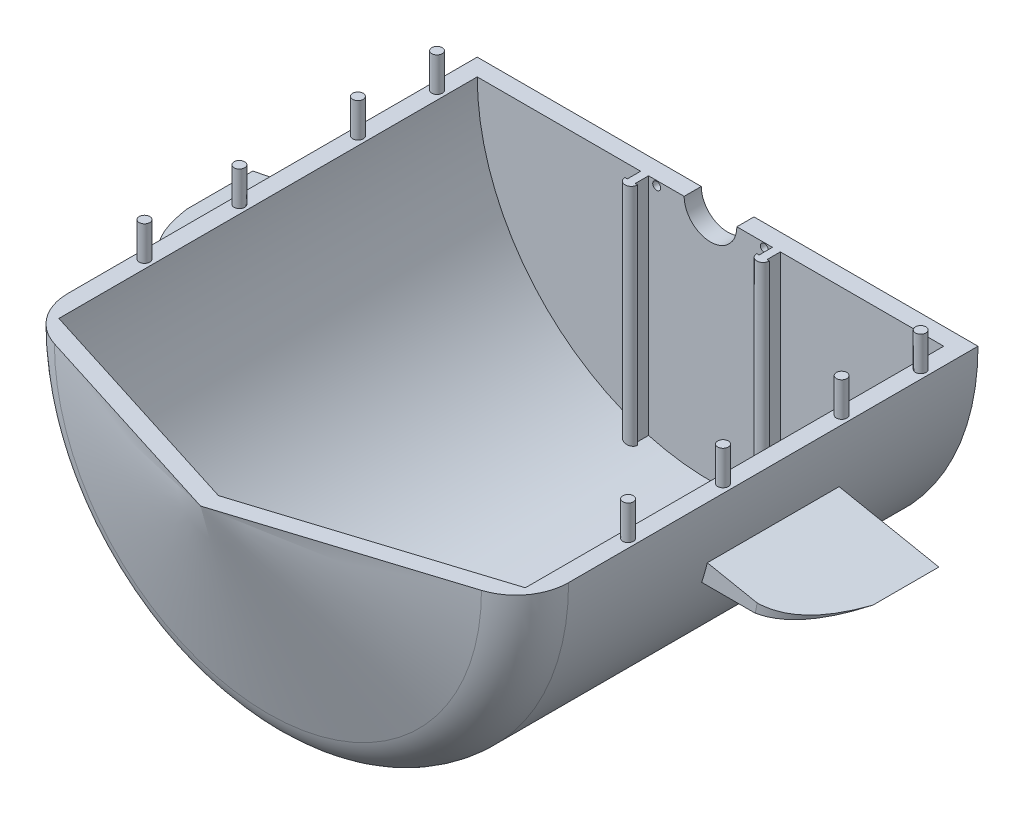
from build123d import *

# Parameters (mm, degrees)
REVOLVE1_ANGLE           = 180
SKETCH3_R                = 2
BOSS_EXTRUDE1_DEPTH      = 13
BOSS_EXTRUDE8_REACH      = 185.507
BOSS_EXTRUDE8_END_RADIUS = 88.5
SKETCH7_R                = 10
SKETCH7_R_2              = 1.5
CUT_EXTRUDE1_DEPTH       = 10
BOSS_EXTRUDE11_DEPTH     = 25
FILLET1_R                = 20
CUT_EXTRUDE2_DEPTH       = 10
CUT_EXTRUDE3_DEPTH       = 10


with BuildPart() as part:
    # Sketch1 → Revolve1 (revolve)
    with BuildSketch(Plane(origin=(0, 0, 0), x_dir=(1, 0, 0), z_dir=(0, 1, 0))):
        Polygon((0, 75), (95, 75), (95, -95), (0, -125), align=None)
    revolve(axis=Axis((0, 0, 125), (0, 0, -1)), revolution_arc=REVOLVE1_ANGLE)

    # Sketch2 → Cut-Revolve3 (revolve, cut)
    with BuildSketch(Plane(origin=(0, 0, 0), x_dir=(1, 0, 0), z_dir=(0, 1, 0))):
        Polygon((0, 68.5), (0, -118.183600921), (88.5, -90.2362325), (88.5, 68.5), align=None)
    revolve(axis=Axis((0, 0, -68.5), (0, 0, 1)), mode=Mode.SUBTRACT)

    # Sketch3 → Boss-Extrude1 (add)
    with BuildSketch(Plane(origin=(0, 0, 0), x_dir=(1, 0, 0), z_dir=(0, 1, 0))):
        with Locations((-91.75, 56.5)):
            Circle(SKETCH3_R)
        with Locations((-91.75, 26.5)):
            Circle(SKETCH3_R)
        with Locations((-91.75, -18.5)):
            Circle(SKETCH3_R)
        with Locations((-91.75, -54.5)):
            Circle(SKETCH3_R)
        with Locations((91.75, -54.5)):
            Circle(SKETCH3_R)
        with Locations((91.75, -18.5)):
            Circle(SKETCH3_R)
        with Locations((91.75, 26.5)):
            Circle(SKETCH3_R)
        with Locations((91.75, 56.5)):
            Circle(SKETCH3_R)
    extrude(amount=BOSS_EXTRUDE1_DEPTH)

    # Boss-Extrude8: up to this cylinder (the profile starts inside it)
    boss_extrude8_end = Plane(origin=(0, 0, -64.648778), z_dir=(0, 0, -1)) * Cylinder(BOSS_EXTRUDE8_END_RADIUS, 549.014, mode=Mode.PRIVATE)
    # Sketch5 → Boss-Extrude8 (add, up to the surface)
    with BuildSketch(Plane(origin=(0, 0, 0), x_dir=(1, 0, 0), z_dir=(0, 1, 0)), mode=Mode.PRIVATE) as boss_extrude8_sk1:
        with BuildLine():
            Line((23.5, 63.447630747), (23.5, 68.5))
            Line((23.5, 68.5), (26.5, 68.5))
            Line((26.5, 68.5), (26.5, 63.447630747))
            Line((26.5, 63.447630747), (27.4, 63.447630747))
            ThreePointArc((27.4, 63.447630747), (25, 61.047630747), (22.6, 63.447630747))
            Line((22.6, 63.447630747), (23.5, 63.447630747))
        make_face()
    boss_extrude8_tool1 = extrude(boss_extrude8_sk1.sketch, amount=-BOSS_EXTRUDE8_REACH, mode=Mode.PRIVATE) & boss_extrude8_end
    add(boss_extrude8_tool1.solids().sort_by_distance((25, 0, -64.648778))[0])
    # Sketch5 → Boss-Extrude8 (add, up to the surface)
    with BuildSketch(Plane(origin=(0, 0, 0), x_dir=(1, 0, 0), z_dir=(0, 1, 0)), mode=Mode.PRIVATE) as boss_extrude8_sk2:
        with BuildLine():
            Line((-27.4, 63.447630747), (-26.5, 63.447630747))
            Line((-26.5, 63.447630747), (-26.5, 68.5))
            Line((-26.5, 68.5), (-23.5, 68.5))
            Line((-23.5, 68.5), (-23.5, 63.447630747))
            Line((-23.5, 63.447630747), (-22.6, 63.447630747))
            ThreePointArc((-22.6, 63.447630747), (-25, 61.047630747), (-27.4, 63.447630747))
        make_face()
    boss_extrude8_tool2 = extrude(boss_extrude8_sk2.sketch, amount=-BOSS_EXTRUDE8_REACH, mode=Mode.PRIVATE) & boss_extrude8_end
    add(boss_extrude8_tool2.solids().sort_by_distance((-25, 0, -64.648778))[0])

    # Sketch7 → Cut-Extrude1 (cut)
    with BuildSketch(Plane.XY.offset(-68.5)):
        Circle(SKETCH7_R)
        with Locations((20.425168298, -1.75)):
            Circle(SKETCH7_R_2)
        with Locations(Location((-20.425168298, -1.75, 0), (0, 0, 180))):
            Circle(SKETCH7_R_2)
    extrude(amount=-CUT_EXTRUDE1_DEPTH, mode=Mode.SUBTRACT)

    # Sketch8 → Boss-Extrude11 (add, symmetric)
    with BuildSketch(Plane.XY):
        Polygon((90.138781887, -30), (130.138781887, -30), (92.29707471, -22.5), align=None)
        Polygon((-130.138781887, -30), (-92.29707471, -22.5), (-90.138781887, -30), align=None)
    extrude(amount=BOSS_EXTRUDE11_DEPTH, both=True)

    # Fillet1
    fillet1_edges = [part.edges().sort_by_distance(p)[0] for p in [
        (0, -95, 95),
    ]]
    fillet(fillet1_edges, radius=FILLET1_R)

    # Sketch9 → Cut-Extrude2 (cut)
    with BuildSketch(Plane(origin=(-0.802339529, -4.048253002, 0), x_dir=(0.9809198737827295, -0.19441245129382567, 0), z_dir=(0.19441245129382567, 0.9809198737827295, 0))):
        with BuildLine():
            Line((114.199203035, -25), (133.488091041, -25))
            Line((133.488091041, -25), (133.488091041, 0))
            add(Edge.make_bspline(
                [(114.199203035, -25), (127.479134843, -22.055909998), (133.488091041, 0)],
                knots=[0, 0, 0, 1, 1, 1], degree=2))
        make_face()
    extrude(amount=-CUT_EXTRUDE2_DEPTH, mode=Mode.SUBTRACT)

    # Sketch10 → Cut-Extrude3 (cut)
    with BuildSketch(Plane(origin=(0.802339529, -4.048253002, 0), x_dir=(0.9809198737827294, 0.1944124512938259, 0), z_dir=(-0.1944124512938259, 0.9809198737827294, 0))):
        with BuildLine():
            Line((-114.199203035, -25), (-133.488091041, -25))
            Line((-133.488091041, -25), (-133.488091041, 0))
            add(Edge.make_bspline(
                [(-114.199203035, -25), (-129.601076996, -21.529037797), (-133.488091041, 0)],
                knots=[0, 0, 0, 1, 1, 1], degree=2))
        make_face()
    extrude(amount=-CUT_EXTRUDE3_DEPTH, mode=Mode.SUBTRACT)


solid = part.part
